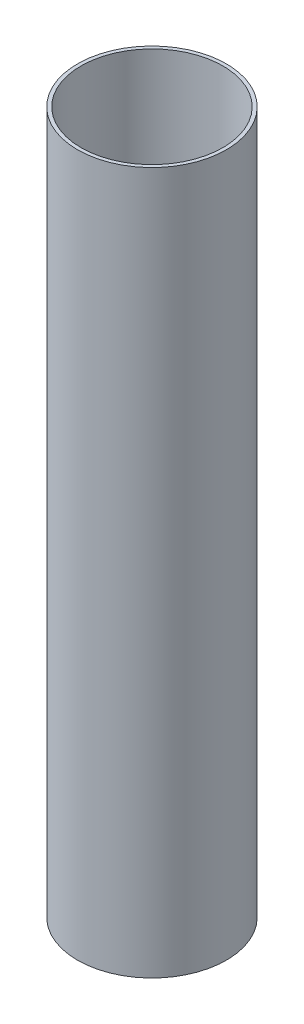
from build123d import *

# Parameters (mm, degrees)
SKETCH1_R           = 21
BOSS_EXTRUDE1_DEPTH = 198
SKETCH2_R           = 20
CUT_EXTRUDE1_DEPTH  = 198


with BuildPart() as part:
    # Sketch1 → Boss-Extrude1 (new body)
    with BuildSketch(Plane(origin=(0, 0, 0), x_dir=(1, 0, 0), z_dir=(0, 1, 0))):
        with Locations(Location((0, 0, 0), (0, 0, 270))):
            Circle(SKETCH1_R)
    extrude(amount=BOSS_EXTRUDE1_DEPTH)

    # Sketch2 → Cut-Extrude1 (cut)
    with BuildSketch(Plane(origin=(0, 198, 0), x_dir=(1, 0, 0), z_dir=(0, 1, 0))):
        with Locations(Location((0, 0, 0), (0, 0, 270))):
            Circle(SKETCH2_R)
    extrude(amount=-CUT_EXTRUDE1_DEPTH, mode=Mode.SUBTRACT)


solid = part.part
